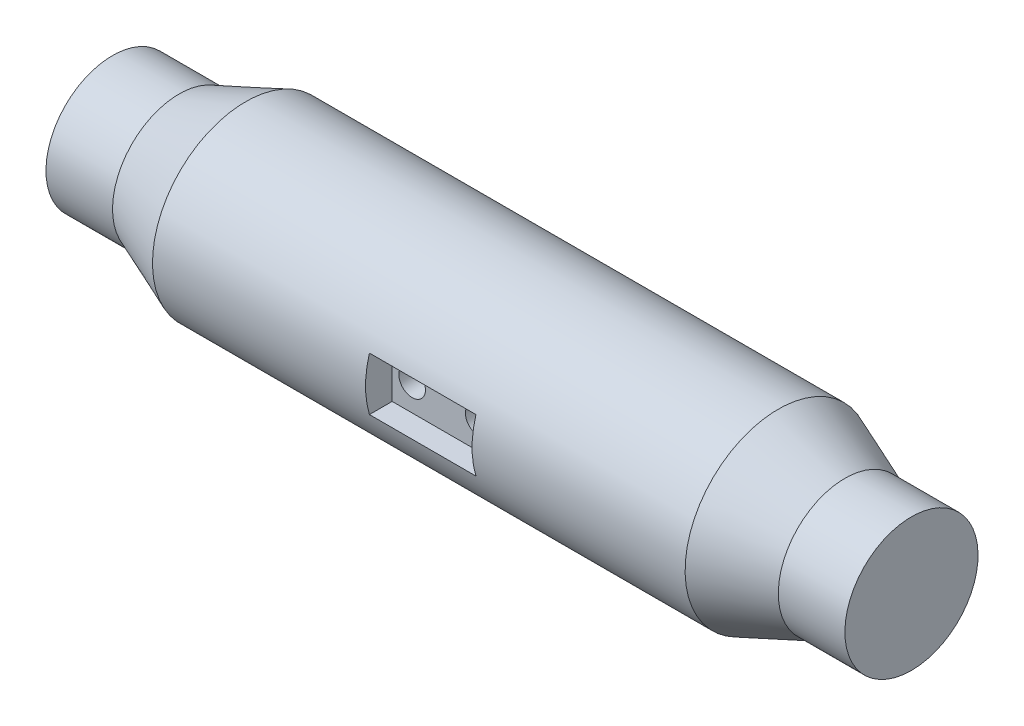
from build123d import *

# Parameters (mm, degrees)
ESQUISSE2_W             = 8
ESQUISSE2_H             = 4
ENL_V_MAT_EXTRU_2_DEPTH = 2
ESQUISSE3_R             = 1
ENL_V_MAT_EXTRU_3_DEPTH = 10


with BuildPart() as part:
    # Esquisse1 → Révolution1 (revolve)
    with BuildSketch(Plane.XY, mode=Mode.PRIVATE) as r_volution1_sk:
        Polygon((-30, 0), (30, 0), (30, 5), (25, 5), (20, 7), (-20, 7), (-25, 5), (-30, 5), align=None)
    revolve(r_volution1_sk.sketch.rotate(Axis((-30, 0, 0), (1, 0, 0)), 180), axis=Axis((-30, 0, 0), (1, 0, 0)))

    # Esquisse2 → Enlèv. mat.-Extru.2 (cut)
    with BuildSketch(Plane.XY.offset(7)):
        Rectangle(ESQUISSE2_W, ESQUISSE2_H)
    extrude(amount=-ENL_V_MAT_EXTRU_2_DEPTH, mode=Mode.SUBTRACT)

    # Esquisse3 → Enlèv. mat.-Extru.3 (cut)
    with BuildSketch(Plane.XY.offset(5)):
        with Locations((2.5, 0)):
            Circle(ESQUISSE3_R)
        with Locations((-2.5, 0)):
            Circle(ESQUISSE3_R)
    extrude(amount=-ENL_V_MAT_EXTRU_3_DEPTH, mode=Mode.SUBTRACT)


solid = part.part
